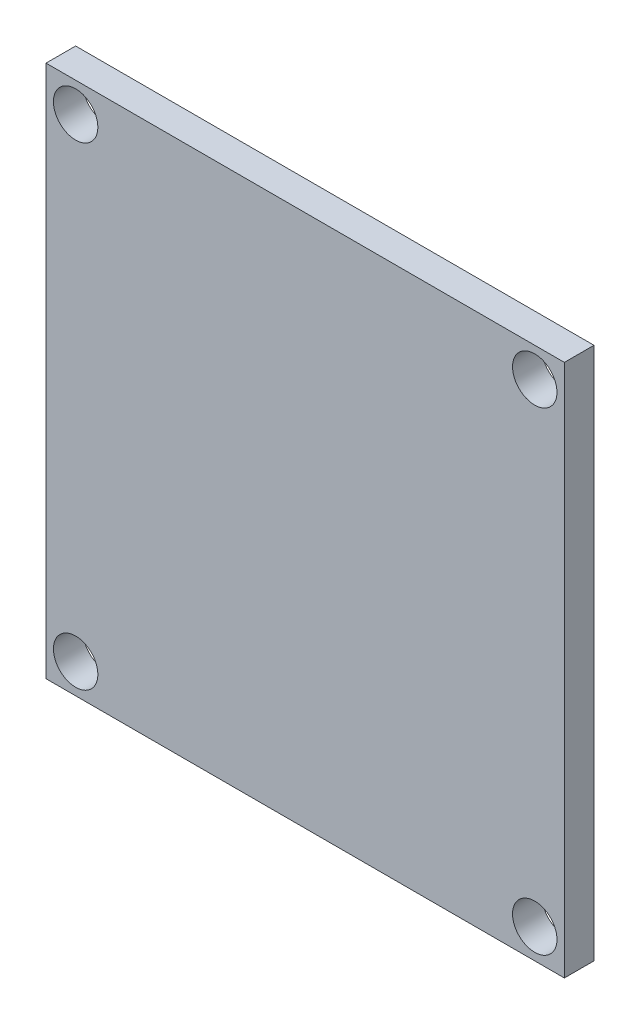
from build123d import *

# Parameters (mm, degrees)
SKETCH_1_W          = 35
SKETCH_1_H          = 36
EXTRUDE_1_DEPTH     = 2
CUT_EXTRUDE_1_REACH = 27.184
SKETCH_2_R          = 1.5


with BuildPart() as part:
    # 草图1 → 凸台-拉伸1 (new body)
    with BuildSketch(Plane.XY):
        Rectangle(SKETCH_1_W, SKETCH_1_H)
    extrude(amount=EXTRUDE_1_DEPTH)

    # 草图2 → 切除-拉伸1 (cut, up to next)
    with BuildSketch(Plane.XY.offset(2), mode=Mode.PRIVATE) as cut_extrude_1_sk1:
        with Locations((-15.5, 16)):
            Circle(SKETCH_2_R)
    cut_extrude_1_tool1 = extrude(cut_extrude_1_sk1.sketch, amount=-CUT_EXTRUDE_1_REACH, mode=Mode.PRIVATE) & part.part
    # 草图2 → 切除-拉伸1 (cut, up to next)
    with BuildSketch(Plane.XY.offset(2), mode=Mode.PRIVATE) as cut_extrude_1_sk2:
        with Locations((15.5, 16)):
            Circle(SKETCH_2_R)
    cut_extrude_1_tool2 = extrude(cut_extrude_1_sk2.sketch, amount=-CUT_EXTRUDE_1_REACH, mode=Mode.PRIVATE) & part.part
    # 草图2 → 切除-拉伸1 (cut, up to next)
    with BuildSketch(Plane.XY.offset(2), mode=Mode.PRIVATE) as cut_extrude_1_sk3:
        with Locations((15.5, -16)):
            Circle(SKETCH_2_R)
    cut_extrude_1_tool3 = extrude(cut_extrude_1_sk3.sketch, amount=-CUT_EXTRUDE_1_REACH, mode=Mode.PRIVATE) & part.part
    # 草图2 → 切除-拉伸1 (cut, up to next)
    with BuildSketch(Plane.XY.offset(2), mode=Mode.PRIVATE) as cut_extrude_1_sk4:
        with Locations((-15.5, -16)):
            Circle(SKETCH_2_R)
    cut_extrude_1_tool4 = extrude(cut_extrude_1_sk4.sketch, amount=-CUT_EXTRUDE_1_REACH, mode=Mode.PRIVATE) & part.part
    add(cut_extrude_1_tool1.solids().sort_by_distance((-15.5, 16, 2))[0], mode=Mode.SUBTRACT)
    add(cut_extrude_1_tool2.solids().sort_by_distance((15.5, 16, 2))[0], mode=Mode.SUBTRACT)
    add(cut_extrude_1_tool3.solids().sort_by_distance((15.5, -16, 2))[0], mode=Mode.SUBTRACT)
    add(cut_extrude_1_tool4.solids().sort_by_distance((-15.5, -16, 2))[0], mode=Mode.SUBTRACT)


solid = part.part
